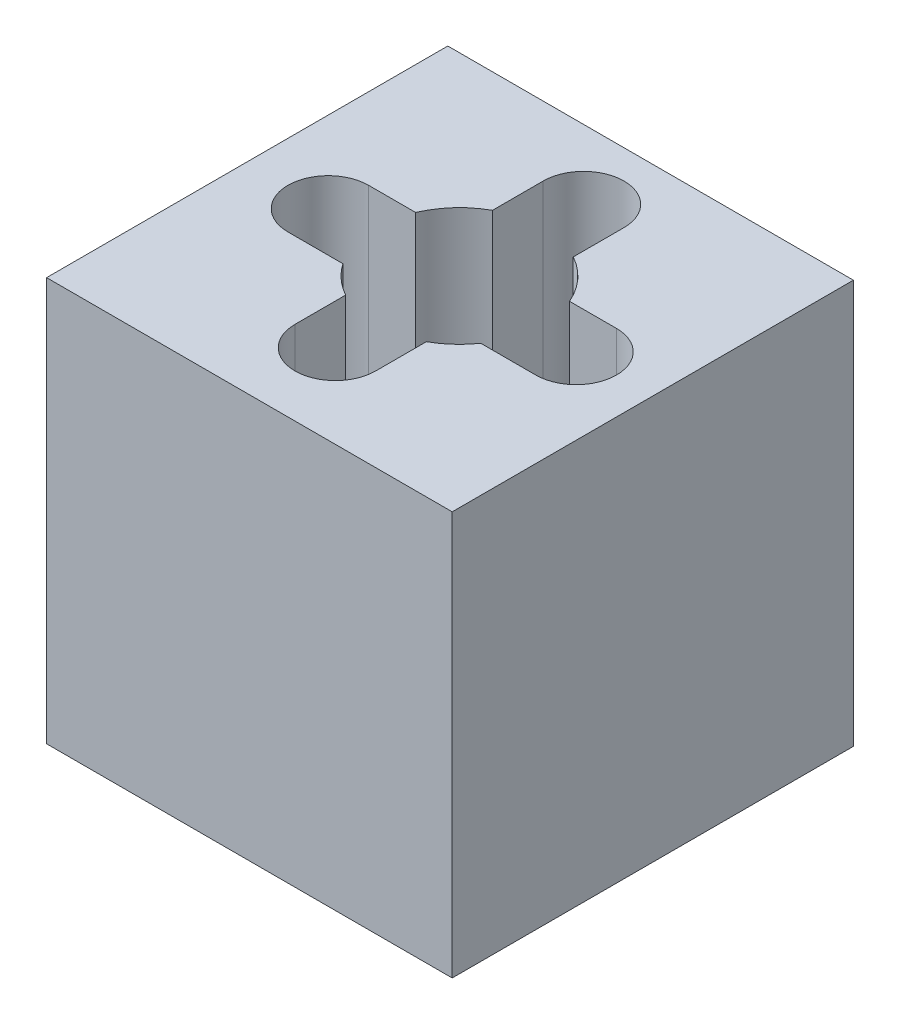
from build123d import *

# Parameters (mm, degrees)
BOSS_EXTRUDE1_DEPTH = 5.08


with BuildPart() as part:
    # Sketch1 → Boss-Extrude1 (new body)
    with BuildSketch(Plane(origin=(0, 0, 0), x_dir=(1, 0, 0), z_dir=(0, 1, 0))):
        Polygon((-2.579450384, -0.091335292), (-2.579450384, 2.43268731), (2.524046381, 2.43268731), (2.524046381, -0.091335292), (2.524046381, -2.615357894), (-2.579450384, -2.615357894), align=None)
        with BuildLine():
            Line((-1.559427547, -0.599335292), (-0.867135524, -0.599335292))
            ThreePointArc((-0.867135524, -0.599335292), (-0.706426639, -0.782360667), (-0.508, -0.923613994))
            Line((-0.508, -0.923613994), (-0.508, -1.5621))
            ThreePointArc((-0.508, -1.5621), (0, -2.0701), (0.508, -1.5621))
            Line((0.508, -1.5621), (0.508, -0.923613994))
            ThreePointArc((0.508, -0.923613994), (0.706426639, -0.782360667), (0.867135524, -0.599335292))
            Line((0.867135524, -0.599335292), (1.559427547, -0.599335292))
            ThreePointArc((1.559427547, -0.599335292), (2.067427547, -0.091335292), (1.559427547, 0.416664708))
            Line((1.559427547, 0.416664708), (0.968254786, 0.416664708))
            ThreePointArc((0.968254786, 0.416664708), (0.7804367, 0.708551598), (0.508, 0.923613994))
            Line((0.508, 0.923613994), (0.508, 1.5621))
            ThreePointArc((0.508, 1.5621), (0, 2.0701), (-0.508, 1.5621))
            Line((-0.508, 1.5621), (-0.508, 0.923613994))
            ThreePointArc((-0.508, 0.923613994), (-0.7804367, 0.708551598), (-0.968254786, 0.416664708))
            Line((-0.968254786, 0.416664708), (-1.559427547, 0.416664708))
            ThreePointArc((-1.559427547, 0.416664708), (-2.067427547, -0.091335292), (-1.559427547, -0.599335292))
        make_face(mode=Mode.SUBTRACT)
    extrude(amount=BOSS_EXTRUDE1_DEPTH)


solid = part.part
